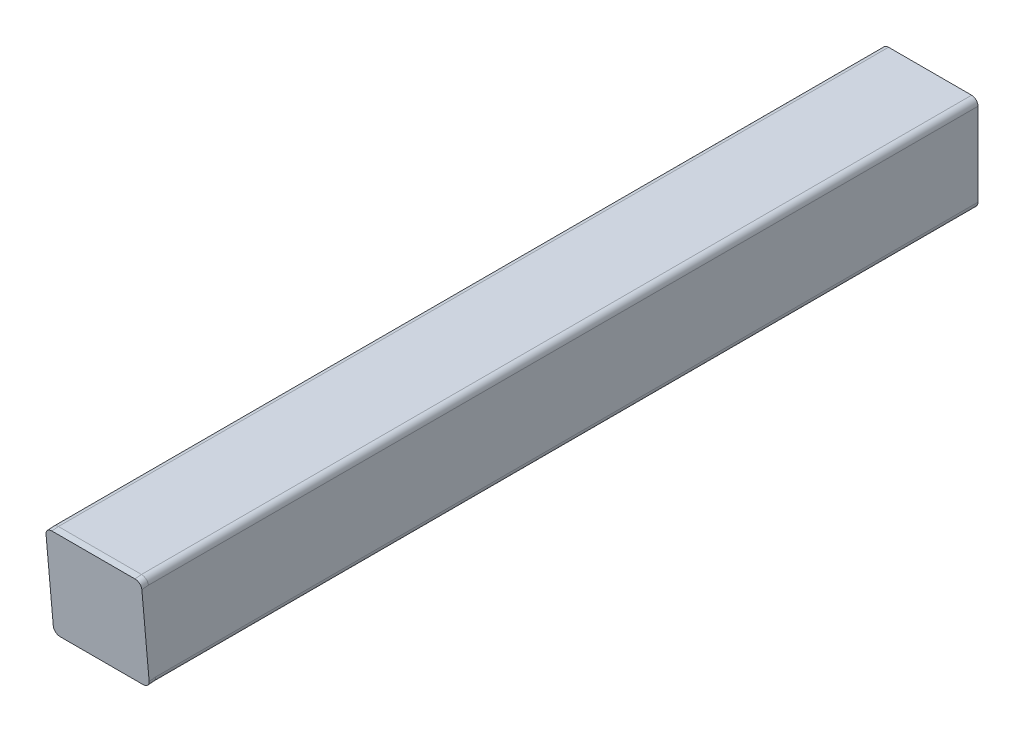
from build123d import *

# Parameters (mm, degrees)
BOSS_EXTRUDE1_DEPTH = 330
CUT_EXTRUDE1_DEPTH  = 335.369885008
BOSS_EXTRUDE2_DEPTH = 2.615348253


with BuildPart() as part:
    # Sketch1 → Boss-Extrude1 (new body)
    with BuildSketch(Plane.XY):
        with BuildLine():
            Line((2.54, 0), (35.56, 0))
            ThreePointArc((35.56, 0), (37.356051224, -0.743948776), (38.1, -2.54))
            Line((38.1, -2.54), (38.1, -35.56))
            ThreePointArc((38.1, -35.56), (37.356051224, -37.356051224), (35.56, -38.1))
            Line((35.56, -38.1), (2.54, -38.1))
            ThreePointArc((2.54, -38.1), (0.743948776, -37.356051224), (0, -35.56))
            Line((0, -35.56), (0, -2.54))
            ThreePointArc((0, -2.54), (0.743948776, -0.743948776), (2.54, 0))
        make_face()
        with BuildLine():
            Line((5.3086, -2.7686), (32.7914, -2.7686))
            ThreePointArc((32.7914, -2.7686), (34.587451224, -3.512548776), (35.3314, -5.3086))
            Line((35.3314, -5.3086), (35.3314, -32.7914))
            ThreePointArc((35.3314, -32.7914), (34.587451224, -34.587451224), (32.7914, -35.3314))
            Line((32.7914, -35.3314), (5.3086, -35.3314))
            ThreePointArc((5.3086, -35.3314), (3.512548776, -34.587451224), (2.7686, -32.7914))
            Line((2.7686, -32.7914), (2.7686, -5.3086))
            ThreePointArc((2.7686, -5.3086), (3.512548776, -3.512548776), (5.3086, -2.7686))
        make_face(mode=Mode.SUBTRACT)
    extrude(amount=BOSS_EXTRUDE1_DEPTH)

    # Sketch2 → Cut-Extrude1 (cut, through all)
    with BuildSketch(Plane(origin=(38.1, 0, 0), x_dir=(0, 0, -1), z_dir=(1, 0, 0))):
        Polygon((-330, 0), (-326.66668192, -38.1), (-330, -38.1), align=None)
    extrude(amount=-CUT_EXTRUDE1_DEPTH, mode=Mode.SUBTRACT)

    # Sketch3 → Boss-Extrude2 (add)
    with BuildSketch(Plane(origin=(0, -28.651949315, 327.493279247), x_dir=(1, 0, 0), z_dir=(0, -0.08715574274765835, 0.9961946980917457))):
        with BuildLine():
            Line((2.54, -9.484140704), (35.56, -9.484140704))
            add(Edge.make_bspline(
                [(35.56, -9.484140704), (38.1, -9.484140704), (38.1, -6.934438316)],
                knots=[0, 0, 0, 1.570796327, 1.570796327, 1.570796327], degree=2, weights=[1, 0.707106781, 1]))
            Line((38.1, -6.934438316), (38.1, 26.211692719))
            add(Edge.make_bspline(
                [(38.1, 26.211692719), (38.1, 28.761395107), (35.56, 28.761395107)],
                knots=[1.570796327, 1.570796327, 1.570796327, 3.141592654, 3.141592654, 3.141592654], degree=2, weights=[1, 0.707106781, 1]))
            Line((35.56, 28.761395107), (2.54, 28.761395107))
            add(Edge.make_bspline(
                [(2.54, 28.761395107), (0, 28.761395107), (0, 26.211692719)],
                knots=[3.141592654, 3.141592654, 3.141592654, 4.71238898, 4.71238898, 4.71238898], degree=2, weights=[1, 0.707106781, 1]))
            Line((0, 26.211692719), (0, -6.934438316))
            add(Edge.make_bspline(
                [(0, -6.934438316), (0, -9.484140704), (2.54, -9.484140704)],
                knots=[4.71238898, 4.71238898, 4.71238898, 6.283185307, 6.283185307, 6.283185307], degree=2, weights=[1, 0.707106781, 1]))
        make_face()
    extrude(amount=BOSS_EXTRUDE2_DEPTH)


solid = part.part
